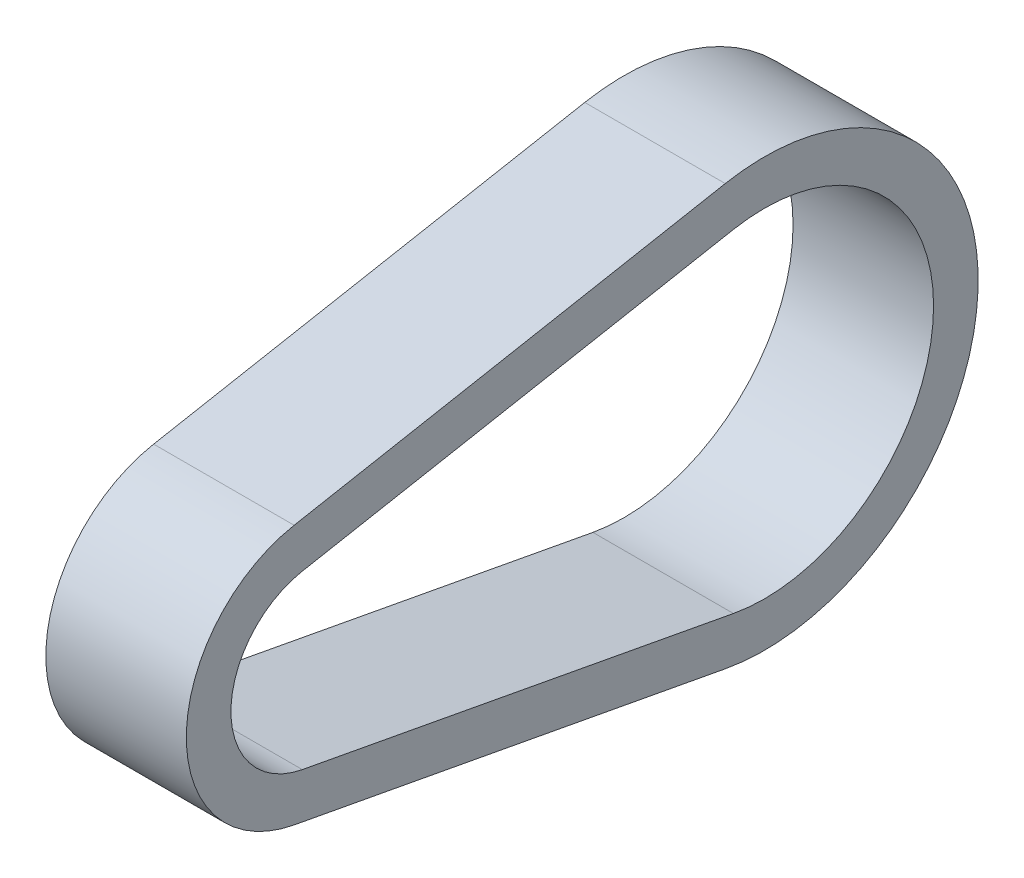
from build123d import *

# Parameters (mm, degrees)
BOSS_EXTRUDE1_DEPTH = 7.5


with BuildPart() as part:
    # Sketch1 → Boss-Extrude1 (new, symmetric)
    with BuildSketch(Plane(origin=(0, 0, 0), x_dir=(0, 0, -1), z_dir=(1, 0, 0))):
        with BuildLine():
            Line((-2.582856777, 13.855780511), (43.442810752, 22.435427625))
            ThreePointArc((43.442810752, 22.435427625), (70.4469, 0), (43.442810752, -22.435427625))
            Line((43.442810752, -22.435427625), (-2.582856777, -13.855780511))
            ThreePointArc((-2.582856777, -13.855780511), (-14.09446, 0), (-2.582856777, 13.855780511))
        make_face()
        with BuildLine():
            Line((-1.710112777, 9.173930005), (44.315554752, 17.753577119))
            ThreePointArc((44.315554752, 17.753577119), (65.6844, 0), (44.315554752, -17.753577119))
            Line((44.315554752, -17.753577119), (-1.710112777, -9.173930005))
            ThreePointArc((-1.710112777, -9.173930005), (-9.33196, 0), (-1.710112777, 9.173930005))
        make_face(mode=Mode.SUBTRACT)
    extrude(amount=BOSS_EXTRUDE1_DEPTH, both=True)


solid = part.part
